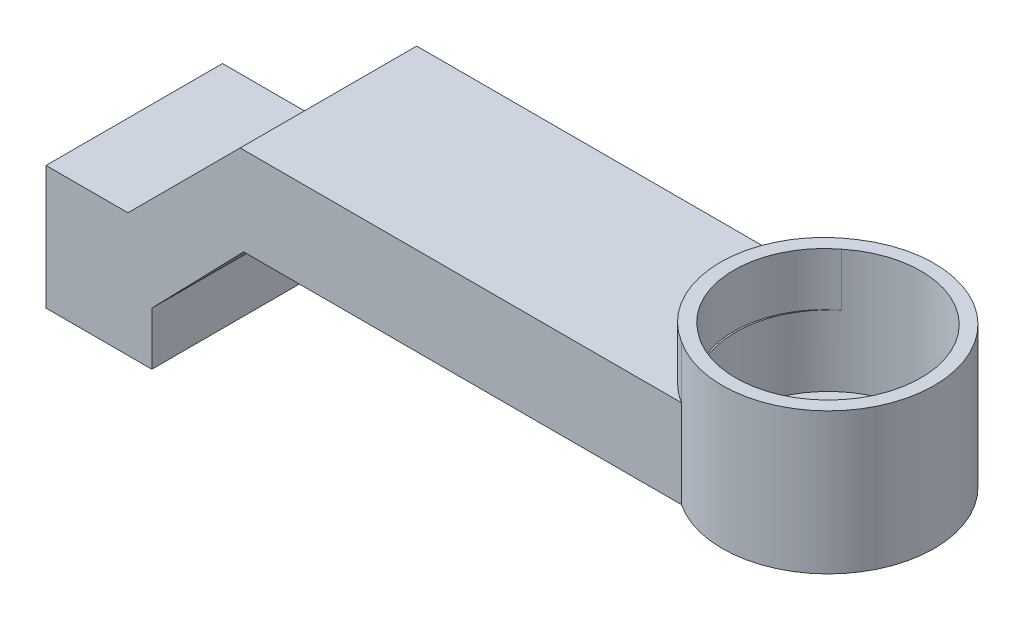
from build123d import *

# Parameters (mm, degrees)
BOSS_EXTRUDE1_DEPTH = 10
BOSS_EXTRUDE4_DEPTH = 8
SKETCH7_R           = 5.25
CUT_EXTRUDE1_DEPTH  = 7
SKETCH8_W           = 10
SKETCH8_H           = 4
BOSS_EXTRUDE5_DEPTH = 11
CUT_EXTRUDE2_DEPTH  = 10
BOSS_EXTRUDE6_DEPTH = 3
BOSS_EXTRUDE7_DEPTH = 10
CUT_EXTRUDE3_DEPTH  = 10
SKETCH13_W          = 5.998509049
SKETCH13_H          = 10
BOSS_EXTRUDE8_DEPTH = 3


with BuildPart() as part:
    # Sketch2 → Boss-Extrude1 (new body)
    with BuildSketch(Plane.XY):
        Polygon((6.476, 10.358), (31.476, 10.358), (31.476, 5.358), (11.456, 5.358), (11.456, 0), (6.476, 0), align=None)
    extrude(amount=BOSS_EXTRUDE1_DEPTH)

    # Sketch6 → Boss-Extrude4 (add)
    with BuildSketch(Plane.XZ.offset(-5.358)):
        with BuildLine():
            Line((31.476, 0), (31.476, 10))
            ThreePointArc((31.476, 10), (40.79262479, 5), (31.476, 0))
        make_face()
    extrude(amount=-BOSS_EXTRUDE4_DEPTH)

    # Sketch7 → Cut-Extrude1 (cut)
    with BuildSketch(Plane(origin=(0, 13.358, 0), x_dir=(1, 0, 0), z_dir=(0, 1, 0))):
        with Locations(Location((34.79262479, -5, 0), (0, 0, 180))):
            Circle(SKETCH7_R)
    extrude(amount=-CUT_EXTRUDE1_DEPTH, mode=Mode.SUBTRACT)

    # Sketch8 → Boss-Extrude5 (add)
    with BuildSketch(Plane.ZY.offset(-6.476)):
        with Locations((5, 2)):
            Rectangle(SKETCH8_W, SKETCH8_H)
    extrude(amount=BOSS_EXTRUDE5_DEPTH)

    # Sketch9 → Cut-Extrude2 (cut)
    with BuildSketch(Plane.XY.offset(10)):
        Polygon((11.456, 5.358), (6.259030685, 0), (11.456, 0), align=None)
    extrude(amount=-CUT_EXTRUDE2_DEPTH, mode=Mode.SUBTRACT)

    # Sketch10 → Boss-Extrude6 (add)
    with BuildSketch(Plane(origin=(0, 10.358, 0), x_dir=(1, 0, 0), z_dir=(0, 1, 0))):
        with BuildLine():
            Line((31.476, -10), (31.476, -9.069705149))
            ThreePointArc((31.476, -9.069705149), (29.453104981, -5), (31.476, -0.930294851))
            Line((31.476, -0.930294851), (31.476, 0))
            ThreePointArc((31.476, 0), (28.684587845, -5), (31.476, -10))
        make_face()
    extrude(amount=BOSS_EXTRUDE6_DEPTH)

    # Sketch11 → Boss-Extrude7 (add)
    with BuildSketch(Plane.XY.offset(10)):
        Polygon((6.476, 4), (6.476, 10.358), (0.118, 4), align=None)
    extrude(amount=-BOSS_EXTRUDE7_DEPTH)

    # Sketch12 → Cut-Extrude3 (cut)
    with BuildSketch(Plane.XY.offset(10)):
        Polygon((6.259030685, 0), (1.474509049, 0), (6.671478364, 5.358), (11.456, 5.358), align=None)
    extrude(amount=-CUT_EXTRUDE3_DEPTH, mode=Mode.SUBTRACT)

    # Sketch13 → Boss-Extrude8 (add)
    with BuildSketch(Plane.XZ):
        with Locations((-1.524745476, 5)):
            Rectangle(SKETCH13_W, SKETCH13_H)
    extrude(amount=BOSS_EXTRUDE8_DEPTH)


solid = part.part
